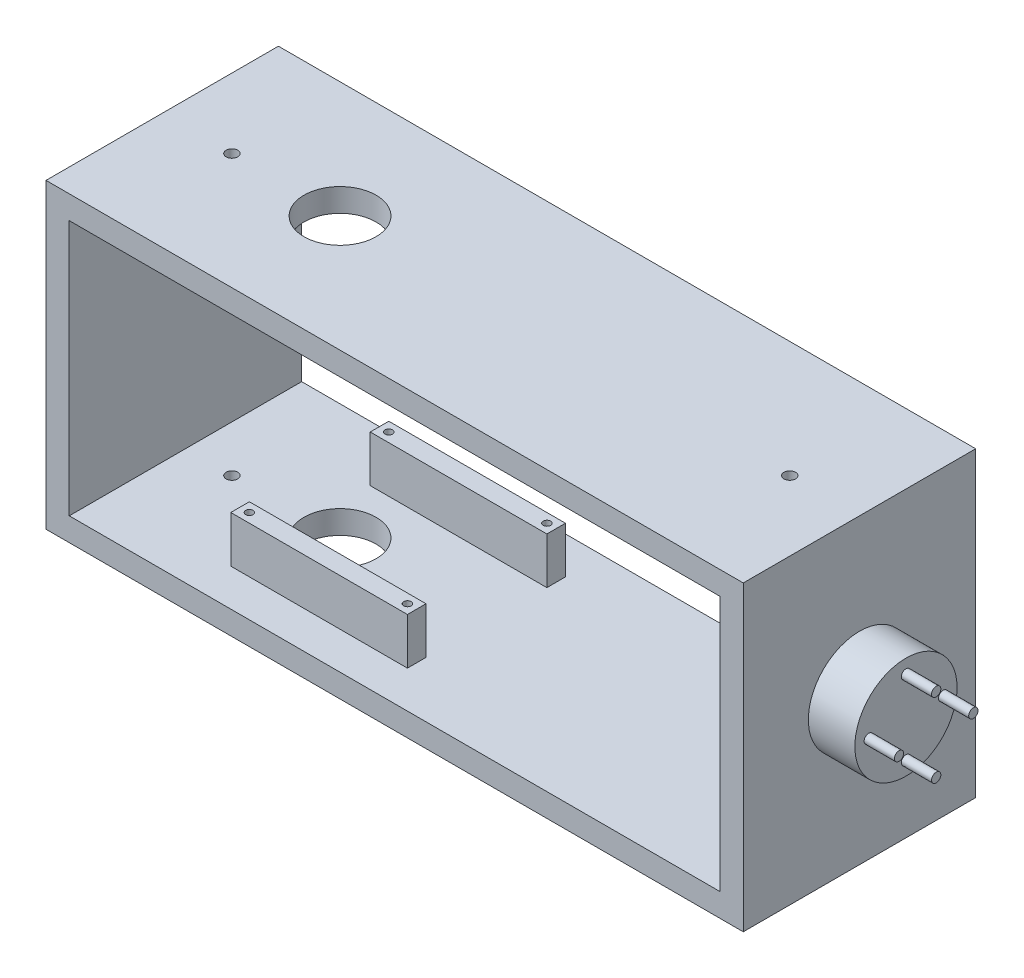
from build123d import *

# Parameters (mm, degrees)
SKETCH1_W                           = 65
SKETCH1_H                           = 150
SKETCH1_W_2                         = 55
SKETCH1_H_2                         = 140
BOSS_EXTRUDE1_DEPTH                 = 50
SKETCH2_R                           = 1.25
CUT_EXTRUDE1_DEPTH                  = 112.130553854
SKETCH3_R                           = 7.75
CUT_EXTRUDE2_DEPTH                  = 112.130553854
M3X0_5_TAPPED_HOLE3_D               = 2.5
M3X0_5_TAPPED_HOLE3_DEPTH           = 5
M3X0_5_TAPPED_HOLE3_TIP             = 0.751075774
M3X0_5_TAPPED_HOLE3_ON_FACE_2_D     = 2.5
M3X0_5_TAPPED_HOLE3_ON_FACE_2_DEPTH = 5
M3X0_5_TAPPED_HOLE3_ON_FACE_2_TIP   = 0.751075774
SKETCH10_W                          = 38
SKETCH10_H                          = 4
SKETCH10_R                          = 0.5
BOSS_EXTRUDE4_DEPTH                 = 10
M2X0_4_TAPPED_HOLE1_D               = 1.6
M2X0_4_TAPPED_HOLE1_DEPTH           = 10
M2X0_4_TAPPED_HOLE1_TIP             = 0.480688495
SKETCH4_R                           = 11
BOSS_EXTRUDE5_DEPTH                 = 10
SKETCH15_R                          = 1
BOSS_EXTRUDE6_DEPTH                 = 6.5


with BuildPart() as part:
    # Sketch1 → Boss-Extrude1 (new body)
    with BuildSketch(Plane(origin=(0, 0, 0), x_dir=(0, 1, 0), z_dir=(0, 0, 1))):
        Rectangle(SKETCH1_W, SKETCH1_H)
        Rectangle(SKETCH1_W_2, SKETCH1_H_2, mode=Mode.SUBTRACT)
    extrude(amount=BOSS_EXTRUDE1_DEPTH)

    # Sketch2 → Cut-Extrude1 (cut, through all)
    with BuildSketch(Plane.XZ.offset(32.5)):
        with Locations((-60, 25)):
            Circle(SKETCH2_R)
        with Locations((60, 25)):
            Circle(SKETCH2_R)
    extrude(amount=-CUT_EXTRUDE1_DEPTH, mode=Mode.SUBTRACT)

    # Sketch3 → Cut-Extrude2 (cut, through all)
    with BuildSketch(Plane.XZ.offset(32.5)):
        with Locations((-36.75, 25)):
            Circle(SKETCH3_R)
    extrude(amount=-CUT_EXTRUDE2_DEPTH, mode=Mode.SUBTRACT)

    # M3x0.5 Tapped Hole3
    with Locations(Plane(origin=(-60, -32.5, 25), x_dir=(0, 0, -1), z_dir=(0, -1, 0))):
        with Locations((0, 0), (0, 120)):
            Hole(M3X0_5_TAPPED_HOLE3_D / 2, depth=M3X0_5_TAPPED_HOLE3_DEPTH)
            with Locations((0, 0, -(M3X0_5_TAPPED_HOLE3_DEPTH + M3X0_5_TAPPED_HOLE3_TIP / 2))):  # 118° drill point
                Cone(0, M3X0_5_TAPPED_HOLE3_D / 2, M3X0_5_TAPPED_HOLE3_TIP, mode=Mode.SUBTRACT)

    # M3x0.5 Tapped Hole3 on face 2
    with Locations(Plane(origin=(60, 32.5, 25), x_dir=(0, 0, -1), z_dir=(0, -1, 0))):
        with Locations((0, 0), (0, -120)):
            Hole(M3X0_5_TAPPED_HOLE3_ON_FACE_2_D / 2, depth=M3X0_5_TAPPED_HOLE3_ON_FACE_2_DEPTH)
            with Locations((0, 0, -(M3X0_5_TAPPED_HOLE3_ON_FACE_2_DEPTH + M3X0_5_TAPPED_HOLE3_ON_FACE_2_TIP / 2))):  # 118° drill point
                Cone(0, M3X0_5_TAPPED_HOLE3_ON_FACE_2_D / 2, M3X0_5_TAPPED_HOLE3_ON_FACE_2_TIP, mode=Mode.SUBTRACT)

    # Sketch10 → Boss-Extrude4 (add)
    # profile 1 of 2: a face of its own
    with BuildSketch(Plane(origin=(0, -27.5, 0), x_dir=(-1, 0, 0), z_dir=(0, 1, 0))):
        with Locations((24.25, 10)):
            Rectangle(SKETCH10_W, SKETCH10_H)
        with Locations((7.25, 10)):
            Circle(SKETCH10_R, mode=Mode.SUBTRACT)
        with Locations((41.25, 10)):
            Circle(SKETCH10_R, mode=Mode.SUBTRACT)
    # profile 2 of 2: a face of its own
    with BuildSketch(Plane(origin=(0, -27.5, 0), x_dir=(-1, 0, 0), z_dir=(0, 1, 0))):
        with Locations((24.25, 40)):
            Rectangle(SKETCH10_W, SKETCH10_H)
        with Locations((7.25, 40)):
            Circle(SKETCH10_R, mode=Mode.SUBTRACT)
        with Locations((41.25, 40)):
            Circle(SKETCH10_R, mode=Mode.SUBTRACT)
    extrude(amount=BOSS_EXTRUDE4_DEPTH)

    # M2x0.4 Tapped Hole1
    with Locations(Plane(origin=(-7.25, -17.5, 10), x_dir=(0, 0, 1), z_dir=(0, 1, 0))):
        with Locations((0, 0), (30, 0), (30, -34), (0, -34)):
            Hole(M2X0_4_TAPPED_HOLE1_D / 2, depth=M2X0_4_TAPPED_HOLE1_DEPTH)
            with Locations((0, 0, -(M2X0_4_TAPPED_HOLE1_DEPTH + M2X0_4_TAPPED_HOLE1_TIP / 2))):  # 118° drill point
                Cone(0, M2X0_4_TAPPED_HOLE1_D / 2, M2X0_4_TAPPED_HOLE1_TIP, mode=Mode.SUBTRACT)

    # Sketch4 → Boss-Extrude5 (add)
    with BuildSketch(Plane.YZ.offset(75)):
        with Locations((0, 25)):
            Circle(SKETCH4_R)
    extrude(amount=BOSS_EXTRUDE5_DEPTH)

    # Sketch15 → Boss-Extrude6 (add)
    with BuildSketch(Plane.YZ.offset(85)):
        with Locations((0, 33)):
            Circle(SKETCH15_R)
        with Locations((8, 25)):
            Circle(SKETCH15_R)
        with Locations((0, 17)):
            Circle(SKETCH15_R)
        with Locations((-8, 25)):
            Circle(SKETCH15_R)
    extrude(amount=BOSS_EXTRUDE6_DEPTH)


solid = part.part
